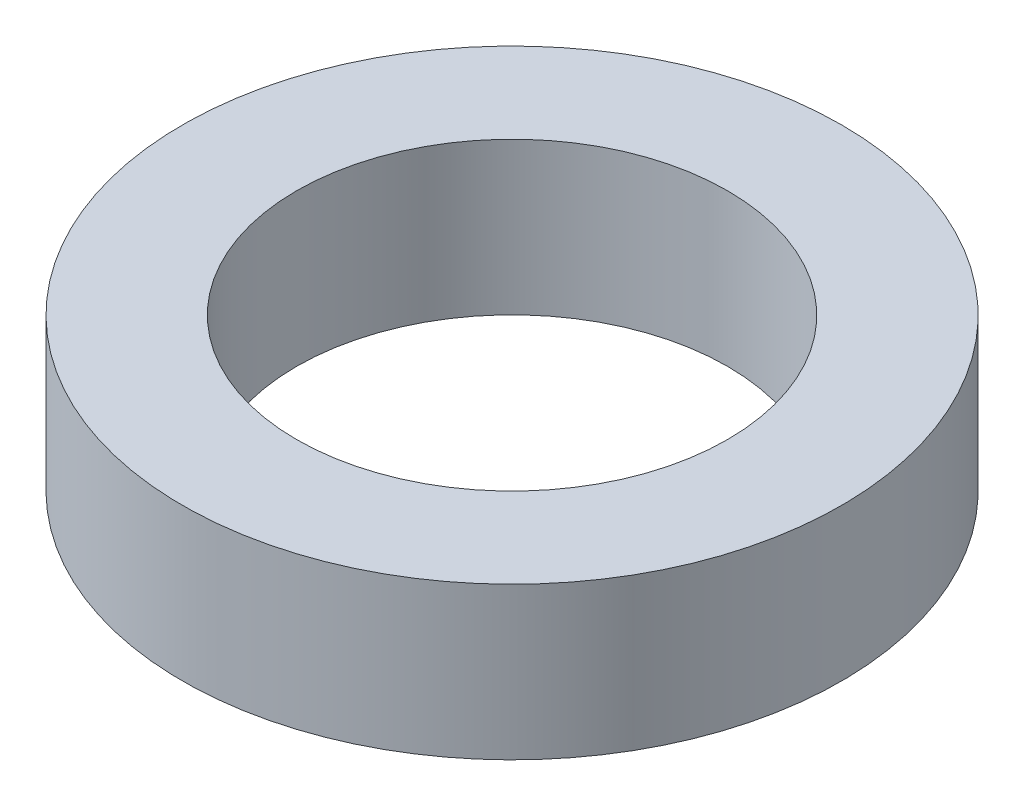
from build123d import *

# Parameters (mm, degrees)
SKETCH1_R           = 16.51
SKETCH1_R_2         = 10.795
BOSS_EXTRUDE1_DEPTH = 7.62


with BuildPart() as part:
    # Sketch1 → Boss-Extrude1 (new body)
    with BuildSketch(Plane(origin=(0, 0, 0), x_dir=(1, 0, 0), z_dir=(0, 1, 0))):
        with Locations(Location((0, 0, 0), (0, 0, 90))):
            Circle(SKETCH1_R)
        with Locations(Location((0, 0, 0), (0, 0, 90))):
            Circle(SKETCH1_R_2, mode=Mode.SUBTRACT)
    extrude(amount=BOSS_EXTRUDE1_DEPTH)


solid = part.part
